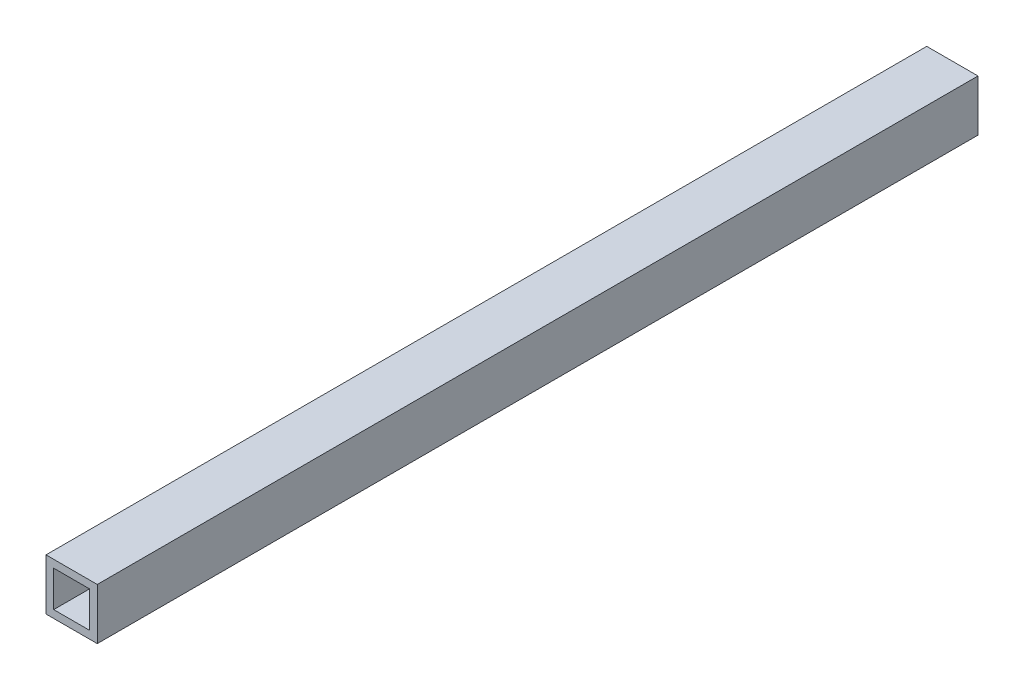
from build123d import *

# Parameters (mm, degrees)
SKETCH1_W           = 10
SKETCH1_H           = 10
SKETCH1_W_2         = 7
SKETCH1_H_2         = 7
BOSS_EXTRUDE1_DEPTH = 171.8


with BuildPart() as part:
    # Sketch1 → Boss-Extrude1 (new body)
    with BuildSketch(Plane.XY):
        Rectangle(SKETCH1_W, SKETCH1_H)
        Rectangle(SKETCH1_W_2, SKETCH1_H_2, mode=Mode.SUBTRACT)
    extrude(amount=BOSS_EXTRUDE1_DEPTH)


solid = part.part
